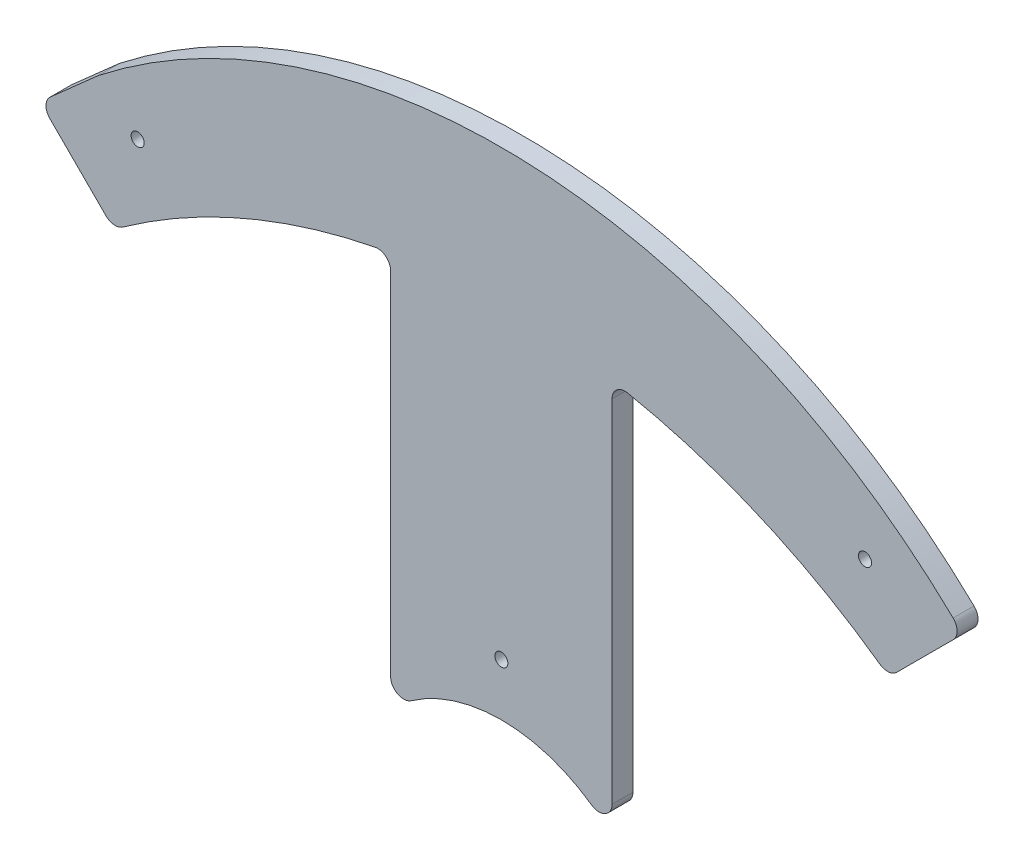
from build123d import *

# Parameters (mm, degrees)
SKETCH1_R           = 1.25
BOSS_EXTRUDE1_DEPTH = 4
FILLET1_R           = 2.5
FILLET2_R           = 2.5
FILLET3_R           = 2.5
FILLET4_R           = 2.5
FILLET5_R           = 2.5


with BuildPart() as part:
    # Sketch1 → Boss-Extrude1 (new body)
    with BuildSketch(Plane.XY):
        with BuildLine():
            Line((-99.804604555, -64.168856805), (-111.028493279, -74.119953323))
            Line((-111.028493279, -74.119953323), (-101.028493279, -84.119953323))
            Line((-101.028493279, -84.119953323), (-96.889069885, -88.259376717))
            ThreePointArc((-96.889069885, -88.259376717), (-71.693791888, -73.845522502), (-43.853349067, -65.631451023))
            Line((-43.853349067, -65.631451023), (-43.853349067, -141.295097535))
            ThreePointArc((-43.853349067, -141.295097535), (-34.120648602, -134.791914996), (-22.640145631, -132.508300971))
            ThreePointArc((-22.640145631, -132.508300971), (-11.15964266, -134.791914996), (-1.426942195, -141.295097535))
            Line((-1.426942195, -141.295097535), (-1.426942195, -65.631451023))
            ThreePointArc((-1.426942195, -65.631451023), (26.413500625, -73.845522502), (51.608778623, -88.259376717))
            Line((51.608778623, -88.259376717), (65.748202017, -74.119953323))
            ThreePointArc((65.748202017, -74.119953323), (25.195283415, -47.023359407), (-22.640145631, -37.508300971))
            ThreePointArc((-22.640145631, -37.508300971), (-63.44684459, -44.356647068), (-99.782209189, -64.15128785))
            ThreePointArc((-99.782209189, -64.15128785), (-99.793407372, -64.16007169), (-99.804604555, -64.168856805))
        make_face()
        with BuildLine():
            ThreePointArc((-21.390145631, -122.508300971), (-21.756262155, -123.392184447), (-22.640145631, -123.758300971))
            ThreePointArc((-22.640145631, -123.758300971), (-23.890145631, -122.508300971), (-22.640145631, -121.258300971))
            ThreePointArc((-22.640145631, -121.258300971), (-21.756262155, -121.624417494), (-21.390145631, -122.508300971))
        make_face(mode=Mode.SUBTRACT)
        with Locations((-92.318549214, -71.021033692)):
            Circle(SKETCH1_R, mode=Mode.SUBTRACT)
        with Locations((47.038257951, -71.021033692)):
            Circle(SKETCH1_R, mode=Mode.SUBTRACT)
    extrude(amount=BOSS_EXTRUDE1_DEPTH)

    # Fillet1
    fillet1_edges = [part.edges().sort_by_distance(p)[0] for p in [
        (65.748202017, -74.119953323, 2),
        (51.608778623, -88.259376717, 2),
    ]]
    fillet(fillet1_edges, radius=FILLET1_R)

    # Fillet2
    fillet2_edges = [part.edges().sort_by_distance(p)[0] for p in [
        (-1.426942195, -141.295097535, 2),
        (-43.853349067, -141.295097535, 2),
    ]]
    fillet(fillet2_edges, radius=FILLET2_R)

    # Fillet3
    fillet3_edges = [part.edges().sort_by_distance(p)[0] for p in [
        (-96.889069885, -88.259376717, 2),
        (-111.028493279, -74.119953323, 2),
    ]]
    fillet(fillet3_edges, radius=FILLET3_R)

    # Fillet4
    fillet4_edges = [part.edges().sort_by_distance(p)[0] for p in [
        (-43.853349067, -65.631451023, 2),
    ]]
    fillet(fillet4_edges, radius=FILLET4_R)

    # Fillet5
    fillet5_edges = [part.edges().sort_by_distance(p)[0] for p in [
        (-1.426942195, -65.631451023, 2),
    ]]
    fillet(fillet5_edges, radius=FILLET5_R)


solid = part.part
